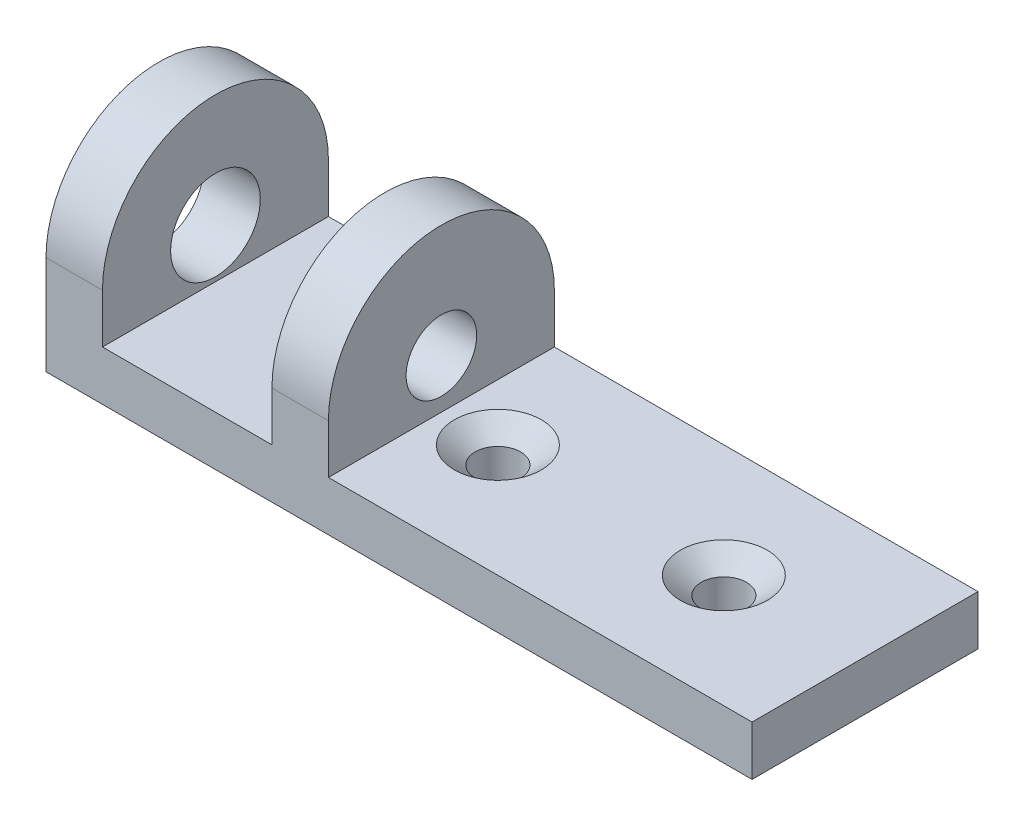
from build123d import *

# Parameters (mm, degrees)
SKETCH1_R                                          = 1.5875
BOSS_EXTRUDE1_DEPTH                                = 79.375
SKETCH2_W                                          = 19.05
SKETCH2_H                                          = 18.2245
SKETCH2_W_2                                        = 47.625
CUT_EXTRUDE1_DEPTH                                 = 85.302079601
CSK_FOR_10_FLAT_HEAD_MACHINE_SCREW_100_D           = 5.1054
CSK_FOR_10_FLAT_HEAD_MACHINE_SCREW_100_CSINK_D     = 9.779
CSK_FOR_10_FLAT_HEAD_MACHINE_SCREW_100_CSINK_ANGLE = 100
TAP_DRILL_FOR_3_8_16_TAP1_REACH                    = 52.899
TAP_DRILL_FOR_3_8_16_TAP1_BORE_R                   = 3.96875
F_3_8_CLEARANCE_HOLE1_REACH                        = 83.382
F_3_8_CLEARANCE_HOLE1_BORE_R                       = 5.0419


with BuildPart() as part:
    # Sketch1 → Boss-Extrude1 (new body)
    with BuildSketch(Plane(origin=(0, 0, 0), x_dir=(0, 0, -1), z_dir=(1, 0, 0))):
        with BuildLine():
            Line((-12.7, 0), (-12.7, -11.1125))
            Line((-12.7, -11.1125), (12.7, -11.1125))
            Line((12.7, -11.1125), (12.7, 0))
            ThreePointArc((12.7, 0), (0, 12.7), (-12.7, 0))
        make_face()
        with Locations(Location((0, 0, 0), (0, 0, 180))):
            Circle(SKETCH1_R, mode=Mode.SUBTRACT)
    extrude(amount=BOSS_EXTRUDE1_DEPTH)

    # Sketch2 → Cut-Extrude1 (cut, through all)
    with BuildSketch(Plane.XY.offset(12.7)):
        with Locations((15.875, 3.58775)):
            Rectangle(SKETCH2_W, SKETCH2_H)
        with Locations((55.5625, 3.58775)):
            Rectangle(SKETCH2_W_2, SKETCH2_H)
    extrude(amount=-CUT_EXTRUDE1_DEPTH, mode=Mode.SUBTRACT)

    # CSK for _10 Flat Head Machine Screw _100 (through all)
    with Locations(Plane(origin=(0, -5.5245, 0), x_dir=(1, 0, 0), z_dir=(0, 1, 0))):
        with Locations((38.1, 0), (63.5, 0)):
            CounterSinkHole(CSK_FOR_10_FLAT_HEAD_MACHINE_SCREW_100_D / 2, CSK_FOR_10_FLAT_HEAD_MACHINE_SCREW_100_CSINK_D / 2, counter_sink_angle=CSK_FOR_10_FLAT_HEAD_MACHINE_SCREW_100_CSINK_ANGLE)

    # Tap Drill for 3/8-16 Tap1 bore → Tap Drill for 3/8-16 Tap1 (cut, up to next)
    with BuildSketch(Plane(origin=(31.75, 0, 0), x_dir=(0, 0, -1), z_dir=(1, 0, 0)), mode=Mode.PRIVATE) as tap_drill_for_3_8_16_tap1_sk1:
        Circle(TAP_DRILL_FOR_3_8_16_TAP1_BORE_R)
    tap_drill_for_3_8_16_tap1_tool1 = extrude(tap_drill_for_3_8_16_tap1_sk1.sketch, amount=-TAP_DRILL_FOR_3_8_16_TAP1_REACH, mode=Mode.PRIVATE) & part.part
    add(tap_drill_for_3_8_16_tap1_tool1.solids().sort_by_distance((31.75, 0, 0))[0], mode=Mode.SUBTRACT)

    # 3/8 Clearance Hole1 bore → 3/8 Clearance Hole1 (cut, up to next)
    with BuildSketch(Plane.ZY, mode=Mode.PRIVATE) as f_3_8_clearance_hole1_sk1:
        Circle(F_3_8_CLEARANCE_HOLE1_BORE_R)
    f_3_8_clearance_hole1_tool1 = extrude(f_3_8_clearance_hole1_sk1.sketch, amount=-F_3_8_CLEARANCE_HOLE1_REACH, mode=Mode.PRIVATE) & part.part
    add(f_3_8_clearance_hole1_tool1.solids().sort_by_distance((0, 0, 0))[0], mode=Mode.SUBTRACT)


solid = part.part
